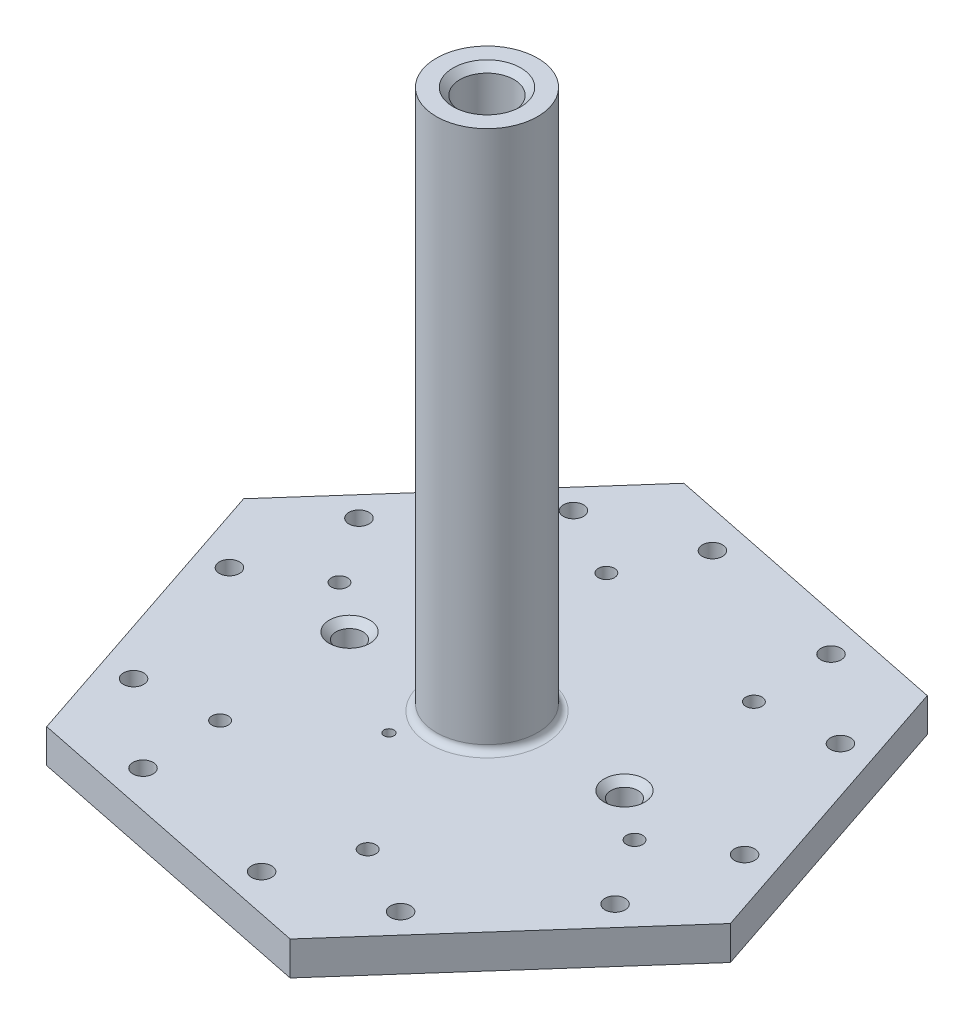
from build123d import *

# Parameters (mm, degrees)
BOSS_EXTRUDE1_DEPTH = 6.35
SKETCH2_R           = 9.525
BOSS_EXTRUDE2_DEPTH = 101.6
FILLET1_R           = 1.27
SKETCH3_R           = 5.08
CUT_EXTRUDE1_DEPTH  = 8.89
CHAMFER1_SIZE       = 1.27
SKETCH9_R           = 0.9525
CUT_EXTRUDE2_DEPTH  = 130.310350126
SKETCH10_R          = 2.54
CUT_EXTRUDE3_DEPTH  = 130.310350126
CHAMFER2_SIZE       = 1.27
SKETCH11_R          = 1.524
CUT_EXTRUDE4_DEPTH  = 135.357021215
SKETCH12_R          = 1.89865
CUT_EXTRUDE5_DEPTH  = 130.310350126


with BuildPart() as part:
    # Sketch1 → Boss-Extrude1 (new body)
    with BuildSketch(Plane(origin=(0, 0, 0), x_dir=(1, 0, 0), z_dir=(0, 1, 0))):
        Polygon((18.605162135, -55.630039325), (57.479608336, -11.702476612), (38.874446201, 43.927562713), (-18.605162135, 55.630039325), (-57.479608336, 11.702476612), (-38.874446201, -43.927562713), align=None)
    extrude(amount=BOSS_EXTRUDE1_DEPTH)

    # Sketch2 → Boss-Extrude2 (add)
    with BuildSketch(Plane(origin=(0, 6.35, 0), x_dir=(1, 0, 0), z_dir=(0, 1, 0))):
        with Locations(Location((0, 0, 0), (0, 0, 270))):
            Circle(SKETCH2_R)
    extrude(amount=BOSS_EXTRUDE2_DEPTH)

    # Fillet1
    fillet1_edges = [part.edges().sort_by_distance(p)[0] for p in [
        (0, 6.35, -9.525),
    ]]
    fillet(fillet1_edges, radius=FILLET1_R)

    # Sketch3 → Cut-Extrude1 (cut)
    with BuildSketch(Plane(origin=(0, 107.95, 0), x_dir=(1, 0, 0), z_dir=(0, 1, 0))):
        with Locations(Location((0, 0, 0), (0, 0, 270))):
            Circle(SKETCH3_R)
    extrude(amount=-CUT_EXTRUDE1_DEPTH, mode=Mode.SUBTRACT)

    # Chamfer1
    chamfer1_edges = [part.edges().sort_by_distance(p)[0] for p in [
        (0, 107.95, -5.08),
    ]]
    chamfer(chamfer1_edges, length=CHAMFER1_SIZE)

    # Sketch9 → Cut-Extrude2 (cut, through all)
    with BuildSketch(Plane(origin=(0, 6.35, 0), x_dir=(1, 0, 0), z_dir=(0, 1, 0))):
        with Locations(Location((-5.682110904, -12.762230043, 0), (0, 0, 270))):
            Circle(SKETCH9_R)
    extrude(amount=-CUT_EXTRUDE2_DEPTH, mode=Mode.SUBTRACT)

    # Sketch10 → Cut-Extrude3 (cut, through all)
    with BuildSketch(Plane(origin=(0, 6.35, 0), x_dir=(1, 0, 0), z_dir=(0, 1, 0))):
        with Locations(Location((-25.854998031, 0, 0), (0, 0, 270))):
            Circle(SKETCH10_R)
        with Locations(Location((25.854998031, 0, 0), (0, 0, 270))):
            Circle(SKETCH10_R)
    extrude(amount=-CUT_EXTRUDE3_DEPTH, mode=Mode.SUBTRACT)

    # Chamfer2
    chamfer2_edges = [part.edges().sort_by_distance(p)[0] for p in [
        (-25.854998031, 6.35, -2.54),
        (25.854998031, 6.35, -2.54),
    ]]
    chamfer(chamfer2_edges, length=CHAMFER2_SIZE)

    # Sketch11 → Cut-Extrude4 (cut, through all)
    with BuildSketch(Plane.XZ):
        with Locations(Location((11.278780135, 33.723919088, 0), (0, 0, 270))):
            Circle(SKETCH11_R)
        with Locations(Location((34.845160713, 7.094249423, 0), (0, 0, 270))):
            Circle(SKETCH11_R)
        with Locations(Location((23.566380578, -26.629669665, 0), (0, 0, 270))):
            Circle(SKETCH11_R)
        with Locations(Location((-11.278780135, -33.723919088, 0), (0, 0, 270))):
            Circle(SKETCH11_R)
        with Locations(Location((-34.845160713, -7.094249423, 0), (0, 0, 270))):
            Circle(SKETCH11_R)
        with Locations(Location((-23.566380578, 26.629669665, 0), (0, 0, 270))):
            Circle(SKETCH11_R)
    extrude(amount=-CUT_EXTRUDE4_DEPTH, mode=Mode.SUBTRACT)

    # Sketch12 → Cut-Extrude5 (cut, through all)
    with BuildSketch(Plane(origin=(0, 6.35, 0), x_dir=(1, 0, 0), z_dir=(0, 1, 0))):
        with Locations(Location((-47.589870854, -0.850796432, 0), (0, 0, 270))):
            Circle(SKETCH12_R)
        with Locations(Location((-38.526565389, -27.95037427, 0), (0, 0, 270))):
            Circle(SKETCH12_R)
        with Locations(Location((-43.469016858, 19.389797212, 0), (0, 0, 270))):
            Circle(SKETCH12_R)
        with Locations(Location((-24.531746751, 40.788638907, 0), (0, 0, 270))):
            Circle(SKETCH12_R)
        with Locations(Location((-4.942451469, 47.340171482, 0), (0, 0, 270))):
            Circle(SKETCH12_R)
        with Locations(Location((23.058124104, 41.639435339, 0), (0, 0, 270))):
            Circle(SKETCH12_R)
        with Locations(Location((38.526565389, 27.95037427, 0), (0, 0, 270))):
            Circle(SKETCH12_R)
        with Locations(Location((47.589870854, 0.850796432, 0), (0, 0, 270))):
            Circle(SKETCH12_R)
        with Locations(Location((43.469016858, -19.389797212, 0), (0, 0, 270))):
            Circle(SKETCH12_R)
        with Locations(Location((24.531746751, -40.788638907, 0), (0, 0, 270))):
            Circle(SKETCH12_R)
        with Locations(Location((4.942451469, -47.340171482, 0), (0, 0, 270))):
            Circle(SKETCH12_R)
        with Locations(Location((-23.058124104, -41.639435339, 0), (0, 0, 270))):
            Circle(SKETCH12_R)
    extrude(amount=-CUT_EXTRUDE5_DEPTH, mode=Mode.SUBTRACT)


solid = part.part
